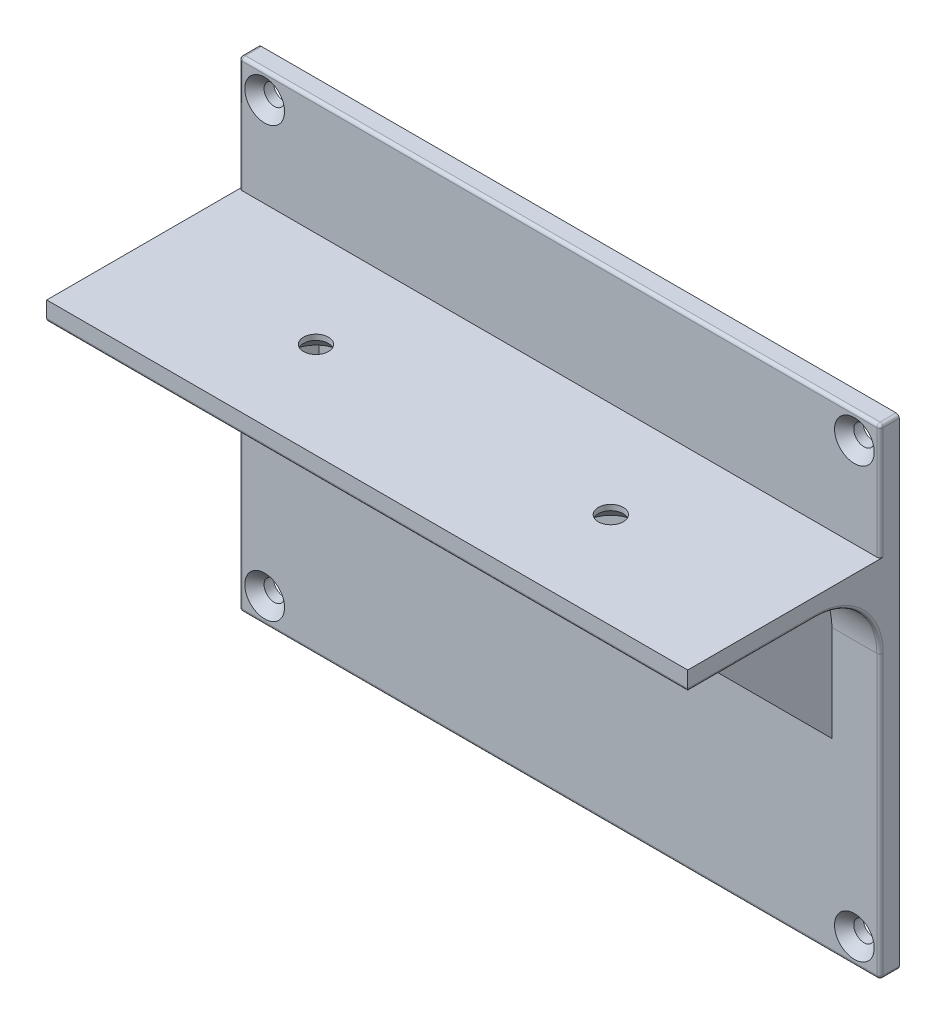
from build123d import *

# Parameters (mm, degrees)
SZKIC1_W                                             = 100
SZKIC1_H                                             = 75
DODANIE_WYCI_GNI_CIE1_DEPTH                          = 3
SZKIC2_W                                             = 30
SZKIC2_H                                             = 3
DODANIE_WYCI_GNI_CIE2_DEPTH                          = 100
EBRO6_REACH                                          = 98.1
SZKIC3_WALL_W                                        = 229.555755292
SZKIC3_WALL_H                                        = 5
SZYK_LINIOWY1_COUNT                                  = 2
SZYK_LINIOWY1_PITCH                                  = 40
SZYK_LINIOWY2_COUNT                                  = 2
SZYK_LINIOWY2_PITCH                                  = 40
SZKIC4_R                                             = 1.6
WYTNIJ_WYCI_GNI_CIE1_DEPTH                           = 77.732214276
SFAZOWANIE1_SIZE                                     = 1.5
POG_BIENIE_STO_KOWE_POD_M3_5_WKR_T_DO_CZ_D           = 3.9
POG_BIENIE_STO_KOWE_POD_M3_5_WKR_T_DO_CZ_CSINK_D     = 8.2
POG_BIENIE_STO_KOWE_POD_M3_5_WKR_T_DO_CZ_CSINK_ANGLE = 90
ZAOKR_GLENIE1_R                                      = 10
ZAOKR_GLENIE2_R                                      = 0.5


with BuildPart() as part:
    # Szkic1 → Dodanie-wyciągnięcie1 (new body)
    with BuildSketch(Plane.XY):
        with Locations((0, -12.378178673)):
            Rectangle(SZKIC1_W, SZKIC1_H)
    extrude(amount=DODANIE_WYCI_GNI_CIE1_DEPTH)

    # Szkic2 → Dodanie-wyciągnięcie2 (add)
    with BuildSketch(Plane.ZY.offset(50)):
        with Locations((18, 5.621821327)):
            Rectangle(SZKIC2_W, SZKIC2_H)
    extrude(amount=-DODANIE_WYCI_GNI_CIE2_DEPTH)

    # Szkic3 wall → Żebro6 (add, up to next)
    with BuildSketch(Plane(origin=(0, -8.378178673, 15.5), x_dir=(0, -0.707106781187, -0.707106781187), z_dir=(0, 0.707106781187, -0.707106781187)), mode=Mode.PRIVATE) as ebro6_sk1:
        Rectangle(SZKIC3_WALL_W, SZKIC3_WALL_H)
    ebro6_tool1 = extrude(ebro6_sk1.sketch, amount=EBRO6_REACH, mode=Mode.PRIVATE) - part.part
    ebro6 = ebro6_tool1.solids().sort_by_distance((0, -8.378178673, 15.5))[0]
    add(ebro6)

    # Szyk liniowy1: Żebro6 ×2
    with Locations(*[(-i * SZYK_LINIOWY1_PITCH, 0, 0) for i in range(1, SZYK_LINIOWY1_COUNT)]):
        add(ebro6)

    # Szyk liniowy2: Żebro6 ×2
    with Locations(*[(i * SZYK_LINIOWY2_PITCH, 0, 0) for i in range(1, SZYK_LINIOWY2_COUNT)]):
        add(ebro6)

    # Szkic4 → Wytnij-wyciągnięcie1 (cut, through all)
    with BuildSketch(Plane.XY.offset(3)):
        with Locations((46, -45.878178673)):
            Circle(SZKIC4_R)
        with Locations((-46, -45.878178673)):
            Circle(SZKIC4_R)
        with Locations((46, 21.121821327)):
            Circle(SZKIC4_R)
        with Locations((-46, 21.121821327)):
            Circle(SZKIC4_R)
    extrude(amount=-WYTNIJ_WYCI_GNI_CIE1_DEPTH, mode=Mode.SUBTRACT)

    # Sfazowanie1
    sfazowanie1_edges = [part.edges().sort_by_distance(p)[0] for p in [
        (-47.6, -45.878178673, 3),
        (44.4, 21.121821327, 3),
        (-47.6, 21.121821327, 3),
        (44.4, -45.878178673, 3),
    ]]
    chamfer(sfazowanie1_edges, length=SFAZOWANIE1_SIZE)

    # Pogłębienie stożkowe pod M3.5 wkręt do części metalowych z łbem soczewkowym1 (through all)
    with Locations(Plane(origin=(0, 4.121821327, 0), x_dir=(-1, 0, 0), z_dir=(0, -1, 0))):
        with Locations((-23, -18), (23, -18)):
            CounterSinkHole(POG_BIENIE_STO_KOWE_POD_M3_5_WKR_T_DO_CZ_D / 2, POG_BIENIE_STO_KOWE_POD_M3_5_WKR_T_DO_CZ_CSINK_D / 2, counter_sink_angle=POG_BIENIE_STO_KOWE_POD_M3_5_WKR_T_DO_CZ_CSINK_ANGLE)

    # Zaokrąglenie1
    zaokr_glenie1_edges = [part.edges().sort_by_distance(p)[0] for p in [
        (46.25, 4.121821327, 3),
        (-20, 4.121821327, 3),
        (-46.25, 4.121821327, 3),
        (20, 4.121821327, 3),
    ]]
    fillet(zaokr_glenie1_edges, radius=ZAOKR_GLENIE1_R)

    # Zaokrąglenie2
    zaokr_glenie2_edges = [part.edges().sort_by_distance(p)[0] for p in [
        (-50, 16.121821327, 3),
        (50, 16.121821327, 3),
        (-50, -27.878178673, 3),
        (-50, 4.121821327, 23),
        (50, 1.192889139, 5.928932188),
        (-50, 1.192889139, 5.928932188),
        (0, 4.121821327, 33),
        (0, -49.878178673, 3),
        (50, 4.121821327, 23),
        (50, -27.878178673, 3),
        (50, -49.878178673, 1.5),
        (-50, -49.878178673, 1.5),
        (-50, 25.121821327, 1.5),
        (50, 25.121821327, 1.5),
        (0, 25.121821327, 3),
    ]]
    fillet(zaokr_glenie2_edges, radius=ZAOKR_GLENIE2_R)


solid = part.part
